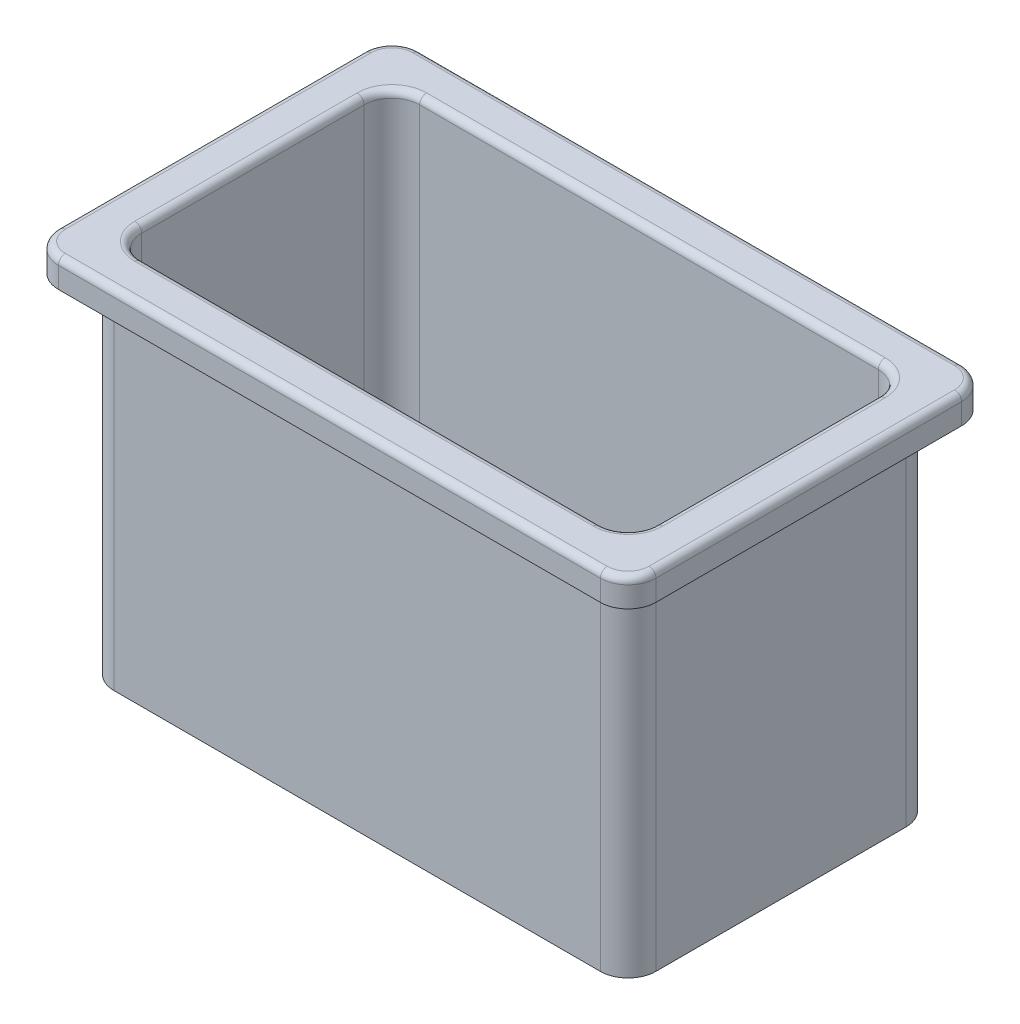
from build123d import *

# Parameters (mm, degrees)
BOSS_EXTRUDE1_DEPTH = 250
CUT_EXTRUDE3_DEPTH  = 10
BOSS_EXTRUDE2_DEPTH = 20
CUT_EXTRUDE4_START  = -240
CUT_EXTRUDE4_DEPTH  = 240
FILLET1_R           = 5
FILLET2_R           = 5


with BuildPart() as part:
    # Sketch1 → Boss-Extrude1 (new body)
    with BuildSketch(Plane(origin=(0, 0, 0), x_dir=(1, 0, 0), z_dir=(0, 1, 0))):
        with BuildLine():
            Line((-175, 110), (175, 110))
            ThreePointArc((175, 110), (189.142135624, 104.142135624), (195, 90))
            Line((195, 90), (195, -90))
            ThreePointArc((195, -90), (189.142135624, -104.142135624), (175, -110))
            Line((175, -110), (-175, -110))
            ThreePointArc((-175, -110), (-189.142135624, -104.142135624), (-195, -90))
            Line((-195, -90), (-195, 90))
            ThreePointArc((-195, 90), (-189.142135624, 104.142135624), (-175, 110))
        make_face()
    extrude(amount=BOSS_EXTRUDE1_DEPTH)

    # Sketch3 → Cut-Extrude3 (cut)
    with BuildSketch(Plane.XZ):
        with BuildLine():
            Line((0, -5.659305135), (-173.94856301, -97.886397626))
            ThreePointArc((-173.94856301, -97.886397626), (-169.597393146, -99.464428485), (-165, -100))
            Line((-165, -100), (165, -100))
            ThreePointArc((165, -100), (169.597393146, -99.464428485), (173.94856301, -97.886397626))
            Line((173.94856301, -97.886397626), (0, -5.659305135))
        make_face()
        with BuildLine():
            ThreePointArc((-185, -80), (-184.19844413, -85.605331658), (-181.8580257, -90.761364667))
            Line((-181.8580257, -90.761364667), (-10.673956744, 0))
            Line((-10.673956744, 0), (-181.8580257, 90.761364667))
            ThreePointArc((-181.8580257, 90.761364667), (-184.19844413, 85.605331658), (-185, 80))
            Line((-185, 80), (-185, -80))
        make_face()
        with BuildLine():
            Line((-173.94856301, 97.886397626), (0, 5.659305135))
            Line((0, 5.659305135), (173.94856301, 97.886397626))
            ThreePointArc((173.94856301, 97.886397626), (169.597393146, 99.464428485), (165, 100))
            Line((165, 100), (-165, 100))
            ThreePointArc((-165, 100), (-169.597393146, 99.464428485), (-173.94856301, 97.886397626))
        make_face()
        with BuildLine():
            Line((181.8580257, 90.761364667), (10.673956744, 0))
            Line((10.673956744, 0), (181.8580257, -90.761364667))
            ThreePointArc((181.8580257, -90.761364667), (184.19844413, -85.605331658), (185, -80))
            Line((185, -80), (185, 80))
            ThreePointArc((185, 80), (184.19844413, 85.605331658), (181.8580257, 90.761364667))
        make_face()
    extrude(amount=-CUT_EXTRUDE3_DEPTH, mode=Mode.SUBTRACT)

    # Sketch5 → Boss-Extrude2 (add)
    with BuildSketch(Plane(origin=(0, 250, 0), x_dir=(1, 0, 0), z_dir=(0, 1, 0))):
        with BuildLine():
            Line((195, 130), (-195, 130))
            ThreePointArc((-195, 130), (-209.142135624, 124.142135624), (-215, 110))
            Line((-215, 110), (-215, -110))
            ThreePointArc((-215, -110), (-209.142135624, -124.142135624), (-195, -130))
            Line((-195, -130), (195, -130))
            ThreePointArc((195, -130), (209.142135624, -124.142135624), (215, -110))
            Line((215, -110), (215, 110))
            ThreePointArc((215, 110), (209.142135624, 124.142135624), (195, 130))
        make_face()
    extrude(amount=BOSS_EXTRUDE2_DEPTH)

    # Sketch6 → Cut-Extrude4 (cut)
    with BuildSketch(Plane(origin=(0, 270, 0), x_dir=(1, 0, 0), z_dir=(0, 1, 0)).offset(CUT_EXTRUDE4_START)):
        with BuildLine():
            Line((-165, -100), (165, -100))
            ThreePointArc((165, -100), (179.142135624, -94.142135624), (185, -80))
            Line((185, -80), (185, 80))
            ThreePointArc((185, 80), (179.142135624, 94.142135624), (165, 100))
            Line((165, 100), (-165, 100))
            ThreePointArc((-165, 100), (-179.142135624, 94.142135624), (-185, 80))
            Line((-185, 80), (-185, -80))
            ThreePointArc((-185, -80), (-179.142135624, -94.142135624), (-165, -100))
        make_face()
    extrude(amount=CUT_EXTRUDE4_DEPTH, mode=Mode.SUBTRACT)

    # Fillet1
    fillet1_edges = [part.edges().sort_by_distance(p)[0] for p in [
        (179.142135624, 270, -94.142135624),
        (0, 270, -100),
        (-179.142135624, 270, -94.142135624),
        (-185, 270, 0),
        (-179.142135624, 270, 94.142135624),
        (0, 270, 100),
        (179.142135624, 270, 94.142135624),
        (185, 270, 0),
    ]]
    fillet(fillet1_edges, radius=FILLET1_R)

    # Fillet2
    fillet2_edges = [part.edges().sort_by_distance(p)[0] for p in [
        (-209.142135624, 270, 124.142135624),
        (0, 270, 130),
        (209.142135624, 270, 124.142135624),
        (215, 270, 0),
        (209.142135624, 270, -124.142135624),
        (0, 270, -130),
        (-209.142135624, 270, -124.142135624),
        (-215, 270, 0),
    ]]
    fillet(fillet2_edges, radius=FILLET2_R)


solid = part.part
